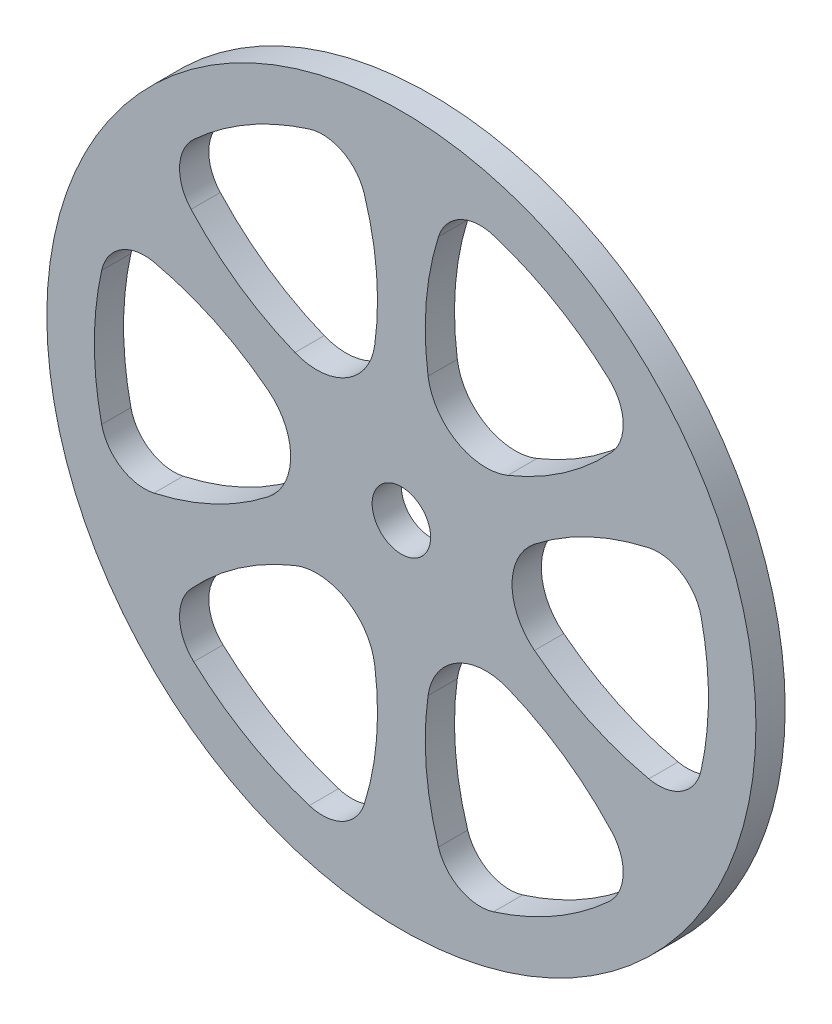
from build123d import *

# Parameters (mm, degrees)
MODEL_R         = 24.25
MODEL_R_2       = 2
EXTRUDE_1_DEPTH = 2


with BuildPart() as part:
    # Model → 凸台-拉伸1 (new body)
    with BuildSketch(Plane.XY):
        with Locations((1461.027973693, 726.314415121)):
            Circle(MODEL_R)
        with Locations((1461.027973693, 726.314415121)):
            Circle(MODEL_R_2, mode=Mode.SUBTRACT)
        with BuildLine():
            ThreePointArc((1454.730507071, 746.347934885), (1450.527973693, 744.5009486), (1446.827169961, 741.784941077))
            ThreePointArc((1446.827169961, 741.784941077), (1445.858696219, 739.705372638), (1446.642743938, 737.549493362))
            ThreePointArc((1446.642743938, 737.549493362), (1449.919857233, 734.687570493), (1453.749968469, 732.623515752))
            ThreePointArc((1453.749968469, 732.623515752), (1457.242892618, 732.870367853), (1459.203134883, 735.771902849))
            ThreePointArc((1459.203134883, 735.771902849), (1459.33066666, 740.120903849), (1458.490725399, 744.389928648))
            ThreePointArc((1458.490725399, 744.389928648), (1457.015703038, 746.146873529), (1454.730507071, 746.347934885))
        make_face(mode=Mode.SUBTRACT)
        with BuildLine():
            ThreePointArc((1440.529703339, 730.877408929), (1440.027973693, 726.314415121), (1440.529703339, 721.751421313))
            ThreePointArc((1440.529703339, 721.751421313), (1441.846425564, 719.87291423), (1444.105495645, 719.473979835))
            ThreePointArc((1444.105495645, 719.473979835), (1448.222550201, 720.881081765), (1451.925129659, 723.166028024))
            ThreePointArc((1451.925129659, 723.166028024), (1453.457811542, 726.314415121), (1451.925129659, 729.462802217))
            ThreePointArc((1451.925129659, 729.462802217), (1448.222550201, 731.747748477), (1444.105495645, 733.154850407))
            ThreePointArc((1444.105495645, 733.154850407), (1441.846425564, 732.755916011), (1440.529703339, 730.877408929))
        make_face(mode=Mode.SUBTRACT)
        with BuildLine():
            ThreePointArc((1446.827169961, 710.843889164), (1450.527973693, 708.127881641), (1454.730507071, 706.280895356))
            ThreePointArc((1454.730507071, 706.280895356), (1457.015703038, 706.481956712), (1458.490725399, 708.238901593))
            ThreePointArc((1458.490725399, 708.238901593), (1459.33066666, 712.507926392), (1459.203134883, 716.856927392))
            ThreePointArc((1459.203134883, 716.856927392), (1457.242892618, 719.758462388), (1453.749968469, 720.005314489))
            ThreePointArc((1453.749968469, 720.005314489), (1449.919857233, 717.941259748), (1446.642743938, 715.079336879))
            ThreePointArc((1446.642743938, 715.079336879), (1445.858696219, 712.923457603), (1446.827169961, 710.843889164))
        make_face(mode=Mode.SUBTRACT)
        with BuildLine():
            ThreePointArc((1467.325440315, 706.280895356), (1471.527973693, 708.127881641), (1475.228777425, 710.843889164))
            ThreePointArc((1475.228777425, 710.843889164), (1476.197251167, 712.923457603), (1475.413203447, 715.079336879))
            ThreePointArc((1475.413203447, 715.079336879), (1472.136090152, 717.941259748), (1468.305978916, 720.005314489))
            ThreePointArc((1468.305978916, 720.005314489), (1464.813054768, 719.758462388), (1462.852812503, 716.856927392))
            ThreePointArc((1462.852812503, 716.856927392), (1462.725280725, 712.507926392), (1463.565221986, 708.238901593))
            ThreePointArc((1463.565221986, 708.238901593), (1465.040244347, 706.481956712), (1467.325440315, 706.280895356))
        make_face(mode=Mode.SUBTRACT)
        with BuildLine():
            ThreePointArc((1481.526244047, 721.751421313), (1482.027973693, 726.314415121), (1481.526244047, 730.877408929))
            ThreePointArc((1481.526244047, 730.877408929), (1480.209521821, 732.755916011), (1477.950451741, 733.154850407))
            ThreePointArc((1477.950451741, 733.154850407), (1473.833397185, 731.747748477), (1470.130817726, 729.462802217))
            ThreePointArc((1470.130817726, 729.462802217), (1468.598135843, 726.314415121), (1470.130817726, 723.166028024))
            ThreePointArc((1470.130817726, 723.166028024), (1473.833397185, 720.881081765), (1477.950451741, 719.473979835))
            ThreePointArc((1477.950451741, 719.473979835), (1480.209521821, 719.87291423), (1481.526244047, 721.751421313))
        make_face(mode=Mode.SUBTRACT)
        with BuildLine():
            ThreePointArc((1475.228777425, 741.784941077), (1471.527973693, 744.5009486), (1467.325440315, 746.347934885))
            ThreePointArc((1467.325440315, 746.347934885), (1465.040244347, 746.146873529), (1463.565221986, 744.389928648))
            ThreePointArc((1463.565221986, 744.389928648), (1462.725280725, 740.120903849), (1462.852812503, 735.771902849))
            ThreePointArc((1462.852812503, 735.771902849), (1464.813054768, 732.870367853), (1468.305978916, 732.623515752))
            ThreePointArc((1468.305978916, 732.623515752), (1472.136090152, 734.687570493), (1475.413203447, 737.549493362))
            ThreePointArc((1475.413203447, 737.549493362), (1476.197251167, 739.705372638), (1475.228777425, 741.784941077))
        make_face(mode=Mode.SUBTRACT)
    extrude(amount=EXTRUDE_1_DEPTH)


solid = part.part
